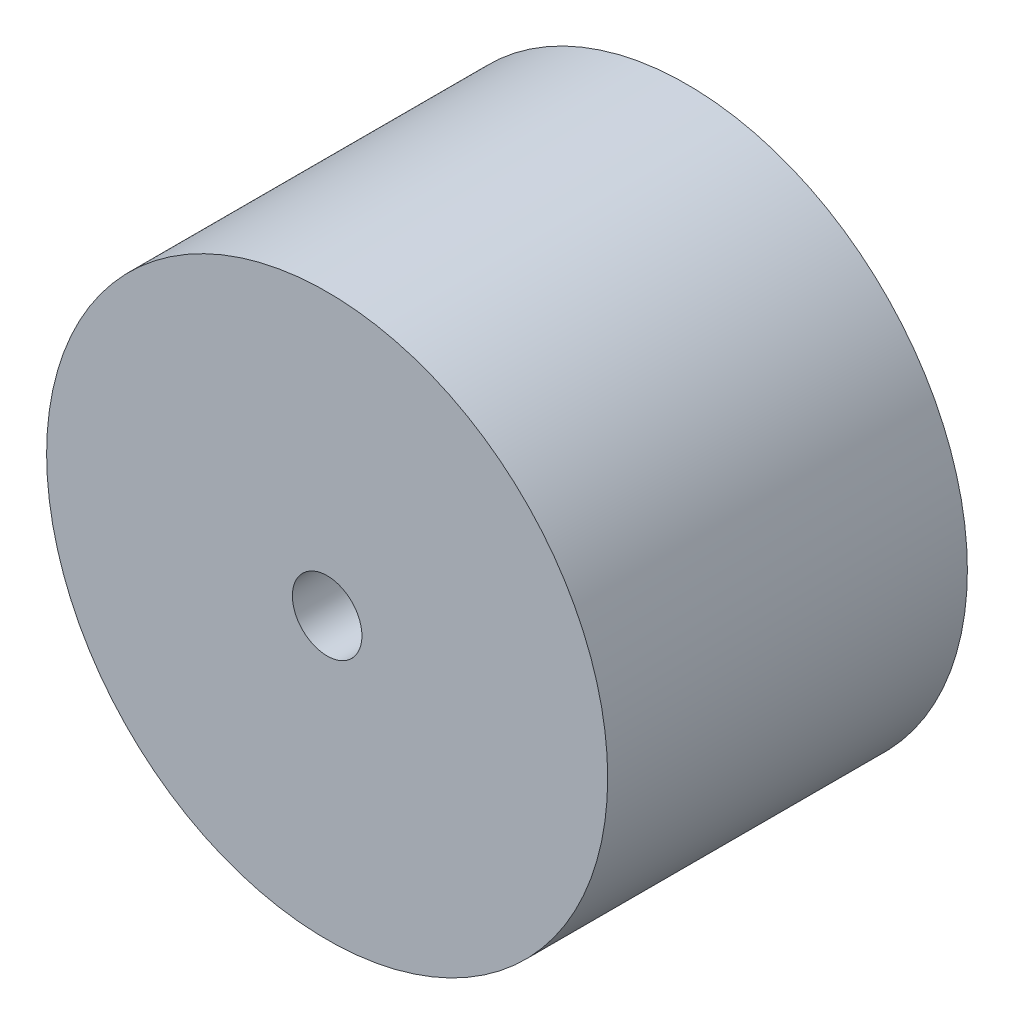
from build123d import *

# Parameters (mm, degrees)
SKETCH1_R           = 409.702
SKETCH1_R_2         = 50.8
BOSS_EXTRUDE1_DEPTH = 525.272


with BuildPart() as part:
    # Sketch1 → Boss-Extrude1 (new body)
    with BuildSketch(Plane.XY):
        Circle(SKETCH1_R)
        Circle(SKETCH1_R_2, mode=Mode.SUBTRACT)
    extrude(amount=BOSS_EXTRUDE1_DEPTH)


solid = part.part
